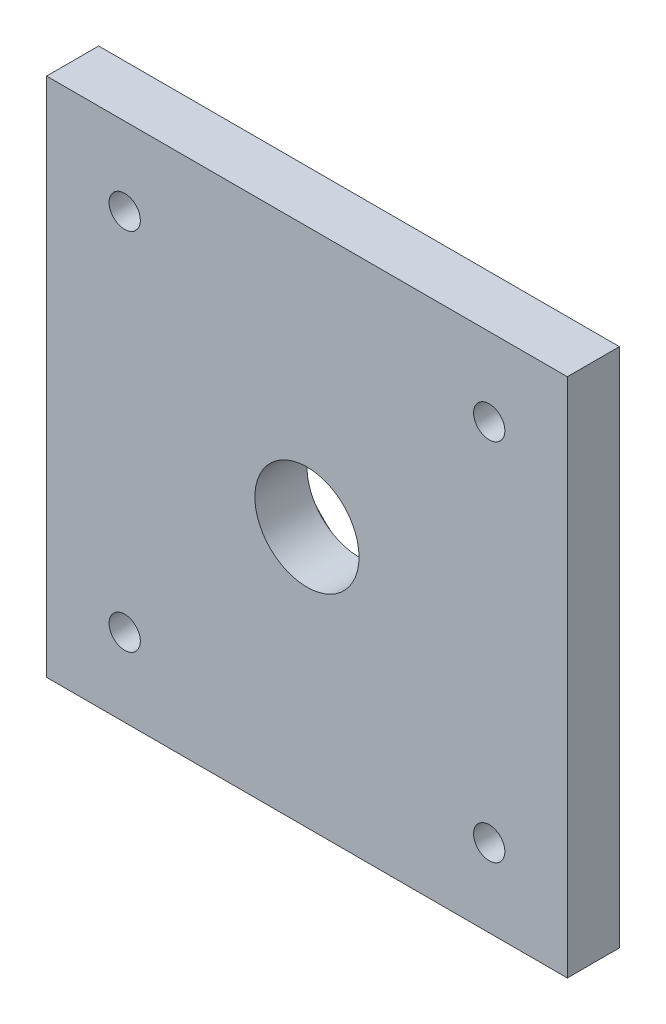
from build123d import *

# Parameters (mm, degrees)
SKETCH1_R           = 17
SKETCH1_R_2         = 12
BOSS_EXTRUDE1_DEPTH = 5
SKETCH2_W           = 50
SKETCH2_H           = 50
BOSS_EXTRUDE2_DEPTH = 5
SKETCH3_R           = 5
CUT_EXTRUDE1_DEPTH  = 37.742346142
SKETCH4_R           = 1.5
CUT_EXTRUDE2_DEPTH  = 37.742346142


with BuildPart() as part:
    # Sketch1 → Boss-Extrude1 (new body)
    with BuildSketch(Plane.XY):
        Circle(SKETCH1_R)
        Circle(SKETCH1_R_2, mode=Mode.SUBTRACT)
    extrude(amount=-BOSS_EXTRUDE1_DEPTH)

    # Sketch2 → Boss-Extrude2 (add)
    with BuildSketch(Plane.XY):
        Rectangle(SKETCH2_W, SKETCH2_H)
    extrude(amount=BOSS_EXTRUDE2_DEPTH)

    # Sketch3 → Cut-Extrude1 (cut, through all)
    with BuildSketch(Plane.XY.offset(5)):
        Circle(SKETCH3_R)
    extrude(amount=-CUT_EXTRUDE1_DEPTH, mode=Mode.SUBTRACT)

    # Sketch4 → Cut-Extrude2 (cut, through all)
    with BuildSketch(Plane.XY.offset(5)):
        with Locations((-17.5, 17.5)):
            Circle(SKETCH4_R)
        with Locations((17.5, 17.5)):
            Circle(SKETCH4_R)
        with Locations((-17.5, -17.5)):
            Circle(SKETCH4_R)
        with Locations((17.5, -17.5)):
            Circle(SKETCH4_R)
    extrude(amount=-CUT_EXTRUDE2_DEPTH, mode=Mode.SUBTRACT)


solid = part.part
